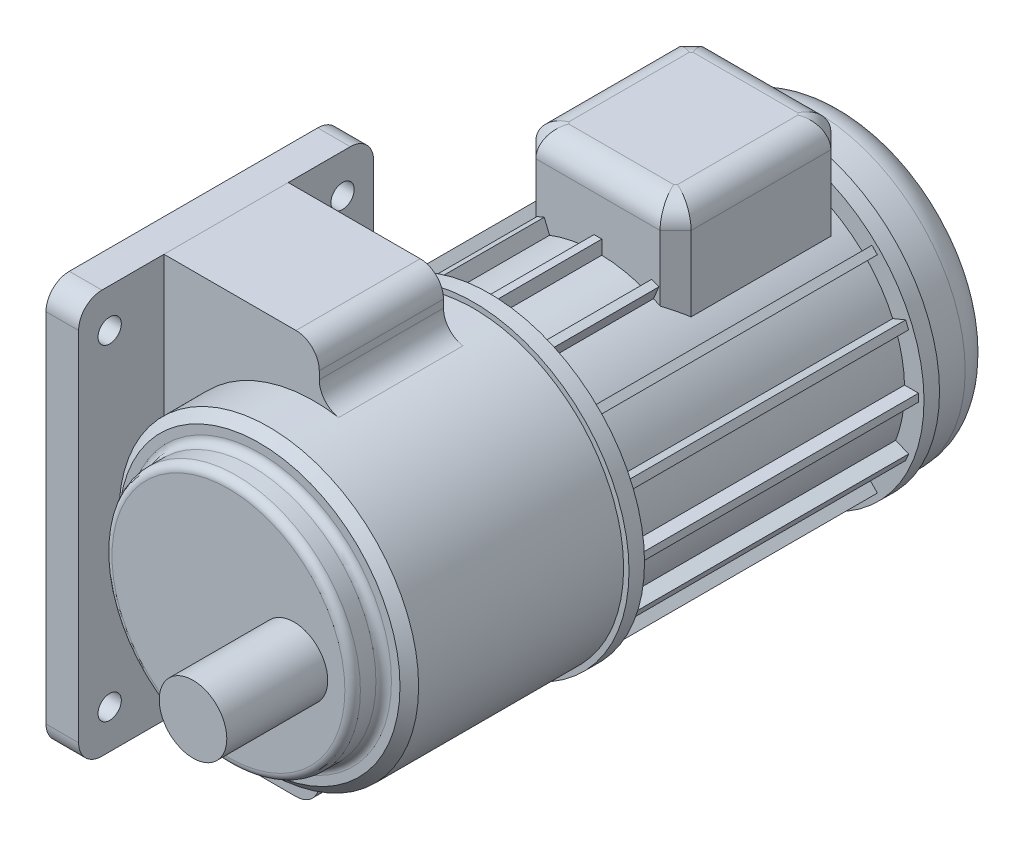
from build123d import *

# Parameters (mm, degrees)
SKETCH1_R                         = 96.5
BOSS_EXTRUDE1_DEPTH               = 463
SKETCH2_W                         = 190
SKETCH2_H                         = 260
BOSS_EXTRUDE2_DEPTH               = 21
CUT_EXTRUDE1_START                = -65
SKETCH3_R                         = 96.5
SKETCH3_R_2                       = 21.75
CUT_EXTRUDE1_DEPTH                = 65
FILLET1_R                         = 20
CUT_EXTRUDE2_START                = -20
SKETCH4_R                         = 96.5
SKETCH4_R_2                       = 80
CUT_EXTRUDE2_DEPTH                = 20
CHAMFER1_SIZE                     = 6
FILLET2_R                         = 5
SKETCH6_W                         = 80
SKETCH6_H                         = 260
BOSS_EXTRUDE6_DEPTH               = 100
FILLET3_R                         = 15
CUT_EXTRUDE3_START                = 200
SKETCH7_R                         = 96.5
SKETCH7_R_2                       = 87.5
CUT_EXTRUDE3_DEPTH                = 200
SKETCH8_W                         = 17.93522229
SKETCH8_H                         = 5
BOSS_EXTRUDE7_DEPTH               = 200
CIRPATTERN1_COUNT                 = 16
SKETCH9_W                         = 100
SKETCH9_H                         = 110
BOSS_EXTRUDE8_DEPTH               = 135
CHAMFER2_SIZE                     = 10
FILLET4_R                         = 15
FILLET5_R                         = 15
F_16_0_MM_DOWEL_HOLES1_AT_2_COUNT = 2
F_16_0_MM_DOWEL_HOLES1_AT_2_PITCH = 150
F_16_0_MM_DOWEL_HOLES1_AT_3_COUNT = 2
F_16_0_MM_DOWEL_HOLES1_AT_3_PITCH = 258.069758011
F_16_0_MM_DOWEL_HOLES1_AT_4_COUNT = 2
F_16_0_MM_DOWEL_HOLES1_AT_4_PITCH = 210
SKETCH12_R                        = 100
BOSS_EXTRUDE11_DEPTH              = 10
SKETCH13_R                        = 100
BOSS_EXTRUDE12_DEPTH              = 10


with BuildPart() as part:
    # Sketch1 → Boss-Extrude1 (new body)
    with BuildSketch(Plane.XY):
        Circle(SKETCH1_R)
    extrude(amount=BOSS_EXTRUDE1_DEPTH)

    # Sketch3 → Cut-Extrude1 (cut)
    with BuildSketch(Plane.XY.offset(463).offset(CUT_EXTRUDE1_START)):
        Circle(SKETCH3_R)
        with Locations((42.2, 0)):
            Circle(SKETCH3_R_2, mode=Mode.SUBTRACT)
    extrude(amount=CUT_EXTRUDE1_DEPTH, mode=Mode.SUBTRACT)

    # Fillet1
    fillet1_edges = [part.edges().sort_by_distance(p)[0] for p in [
        (-96.5, 0, 0),
    ]]
    fillet(fillet1_edges, radius=FILLET1_R)

    # Sketch4 → Cut-Extrude2 (cut)
    with BuildSketch(Plane.XY.offset(398).offset(CUT_EXTRUDE2_START)):
        Circle(SKETCH4_R)
        Circle(SKETCH4_R_2, mode=Mode.SUBTRACT)
    extrude(amount=CUT_EXTRUDE2_DEPTH, mode=Mode.SUBTRACT)

    # Chamfer1
    chamfer1_edges = [part.edges().sort_by_distance(p)[0] for p in [
        (-96.5, 0, 378),
    ]]
    chamfer(chamfer1_edges, length=CHAMFER1_SIZE)

    # Fillet2
    fillet2_edges = [part.edges().sort_by_distance(p)[0] for p in [
        (-80, 0, 378),
        (-80, 0, 398),
    ]]
    fillet(fillet2_edges, radius=FILLET2_R)

    # Sketch6 → Boss-Extrude6 (add)
    with BuildSketch(Plane(origin=(-96.5, 0, 0), x_dir=(0, 0, -1), z_dir=(1, 0, 0))):
        with Locations((-303, 0)):
            Rectangle(SKETCH6_W, SKETCH6_H)
    extrude(amount=BOSS_EXTRUDE6_DEPTH)

    # Fillet3
    fillet3_edges = [part.edges().sort_by_distance(p)[0] for p in [
        (3.5, -96.43650761, 303),
        (3.5, 96.43650761, 303),
        (3.5, -130, 303),
        (3.5, 130, 303),
    ]]
    fillet(fillet3_edges, radius=FILLET3_R)

    # Sketch7 → Cut-Extrude3 (cut)
    with BuildSketch(Plane(origin=(0, 0, 240), x_dir=(-1, 0, 0), z_dir=(0, 0, -1)).offset(CUT_EXTRUDE3_START)):
        Circle(SKETCH7_R)
        Circle(SKETCH7_R_2, mode=Mode.SUBTRACT)
    extrude(amount=-CUT_EXTRUDE3_DEPTH, mode=Mode.SUBTRACT)

    # Sketch8 → Boss-Extrude7 (add)
    with BuildSketch(Plane(origin=(0, 0, 240), x_dir=(-1, 0, 0), z_dir=(0, 0, -1))):
        with Locations((-87.5, 0)):
            Rectangle(SKETCH8_W, SKETCH8_H)
    boss_extrude7 = extrude(amount=BOSS_EXTRUDE7_DEPTH)

    # CirPattern1: Boss-Extrude7 ×16 about axis
    cirpattern1_axis = Axis((0, 0, 0), (0, 0, 1))
    for i in range(1, CIRPATTERN1_COUNT):
        add(boss_extrude7.rotate(cirpattern1_axis, i * 360 / CIRPATTERN1_COUNT))

    # Sketch9 → Boss-Extrude8 (add)
    with BuildSketch(Plane(origin=(0, 0, 0), x_dir=(1, 0, 0), z_dir=(0, 1, 0))):
        with Locations((0, -105)):
            Rectangle(SKETCH9_W, SKETCH9_H)
    extrude(amount=BOSS_EXTRUDE8_DEPTH)

    # Chamfer2
    chamfer2_edges = [part.edges().sort_by_distance(p)[0] for p in [
        (-50, 103.403516541, 50),
        (50, 103.403516541, 160),
        (50, 103.403516541, 50),
        (-50, 103.403516541, 160),
    ]]
    chamfer(chamfer2_edges, length=CHAMFER2_SIZE)

    # Fillet4
    fillet4_edges = [part.edges().sort_by_distance(p)[0] for p in [
        (0, 135, 50),
        (50, 135, 105),
        (-50, 135, 105),
        (0, 135, 160),
        (-45, 135, 55),
        (-45, 135, 155),
        (45, 135, 155),
        (45, 135, 55),
    ]]
    fillet(fillet4_edges, radius=FILLET4_R)

    # Sketch13 → Boss-Extrude12 (add)
    with BuildSketch(Plane.XY.offset(40)):
        with Locations(Location((0, 0, 0), (0, 0, 180))):
            Circle(SKETCH13_R)
    extrude(amount=BOSS_EXTRUDE12_DEPTH)


with BuildPart() as body_2:
    # Sketch2 → Boss-Extrude2 (new body)
    with BuildSketch(Plane.ZY.offset(96.5)):
        with Locations((303, 0)):
            Rectangle(SKETCH2_W, SKETCH2_H)
    extrude(amount=BOSS_EXTRUDE2_DEPTH)

    # Fillet5
    fillet5_edges = [body_2.edges().sort_by_distance(p)[0] for p in [
        (-107, 130, 208),
        (-107, 130, 398),
        (-107, -130, 398),
        (-107, -130, 208),
    ]]
    fillet(fillet5_edges, radius=FILLET5_R)

    # Sketch11 → Ø16.0 mm Dowel Holes1 (revolve, cut)
    with BuildSketch(Plane(origin=(-117.5, 105, 228), x_dir=(0, 0, 1), z_dir=(0, 1, 0))):
        Polygon((0, 0), (0, 34.506454643), (7.5, 30), (7.5, 0), align=None)
    f_16_0_mm_dowel_holes1 = revolve(axis=Axis((-123.85, 105, 228), (1, 0, 0)), mode=Mode.SUBTRACT)

    # Ø16.0 mm Dowel Holes1 at 2: Ø16.0 mm Dowel Holes1 ×2
    with Locations(*[(0, 0, i * F_16_0_MM_DOWEL_HOLES1_AT_2_PITCH) for i in range(1, F_16_0_MM_DOWEL_HOLES1_AT_2_COUNT)]):
        add(f_16_0_mm_dowel_holes1, mode=Mode.SUBTRACT)

    # Ø16.0 mm Dowel Holes1 at 3: Ø16.0 mm Dowel Holes1 ×2
    with Locations(*[Vector(0, -0.8137334712067349, 0.5812381937190965) * (i * F_16_0_MM_DOWEL_HOLES1_AT_3_PITCH) for i in range(1, F_16_0_MM_DOWEL_HOLES1_AT_3_COUNT)]):
        add(f_16_0_mm_dowel_holes1, mode=Mode.SUBTRACT)

    # Ø16.0 mm Dowel Holes1 at 4: Ø16.0 mm Dowel Holes1 ×2
    with Locations(*[(0, -i * F_16_0_MM_DOWEL_HOLES1_AT_4_PITCH, 0) for i in range(1, F_16_0_MM_DOWEL_HOLES1_AT_4_COUNT)]):
        add(f_16_0_mm_dowel_holes1, mode=Mode.SUBTRACT)


with BuildPart() as body_3:
    # Sketch12 → Boss-Extrude11 (new body)
    with BuildSketch(Plane(origin=(0, 0, 240), x_dir=(-1, 0, 0), z_dir=(0, 0, -1))):
        Circle(SKETCH12_R)
    extrude(amount=BOSS_EXTRUDE11_DEPTH)


solid = Compound([part.part, body_2.part, body_3.part])
